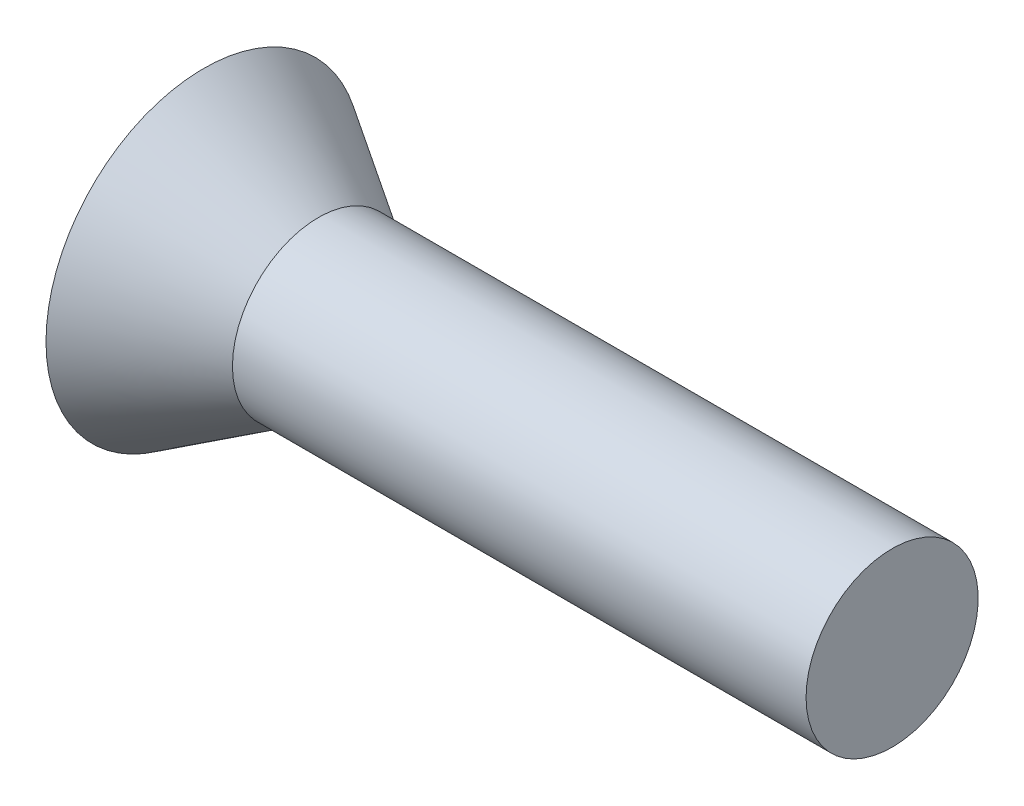
from build123d import *

# Parameters (mm, degrees)
CUT_EXTRUDE_1_DEPTH = 1


with BuildPart() as part:
    # 草图4 → 旋转1 (revolve)
    with BuildSketch(Plane(origin=(0, 0, 0), x_dir=(1, 0, 0), z_dir=(0, 1, 0)), mode=Mode.PRIVATE) as revolve_1_sk:
        Polygon((0, 0), (0, 2.75), (2, 1.5), (12, 1.5), (12, 0), align=None)
    revolve(revolve_1_sk.sketch.rotate(Axis((-2.103529412, 0, 0), (1, 0, 0)), 180), axis=Axis((-2.103529412, 0, 0), (1, 0, 0)))

    # 草图5 → 切除-拉伸1 (cut)
    with BuildSketch(Plane.ZY):
        Polygon((-0.25, 0.25), (-1.25, 0.25), (-1.25, -0.25), (-0.25, -0.25), (-0.25, -1.25), (0.25, -1.25), (0.25, -0.25), (1.25, -0.25), (1.25, 0.25), (0.25, 0.25), (0.25, 1.25), (-0.25, 1.25), align=None)
    extrude(amount=-CUT_EXTRUDE_1_DEPTH, mode=Mode.SUBTRACT)


solid = part.part
